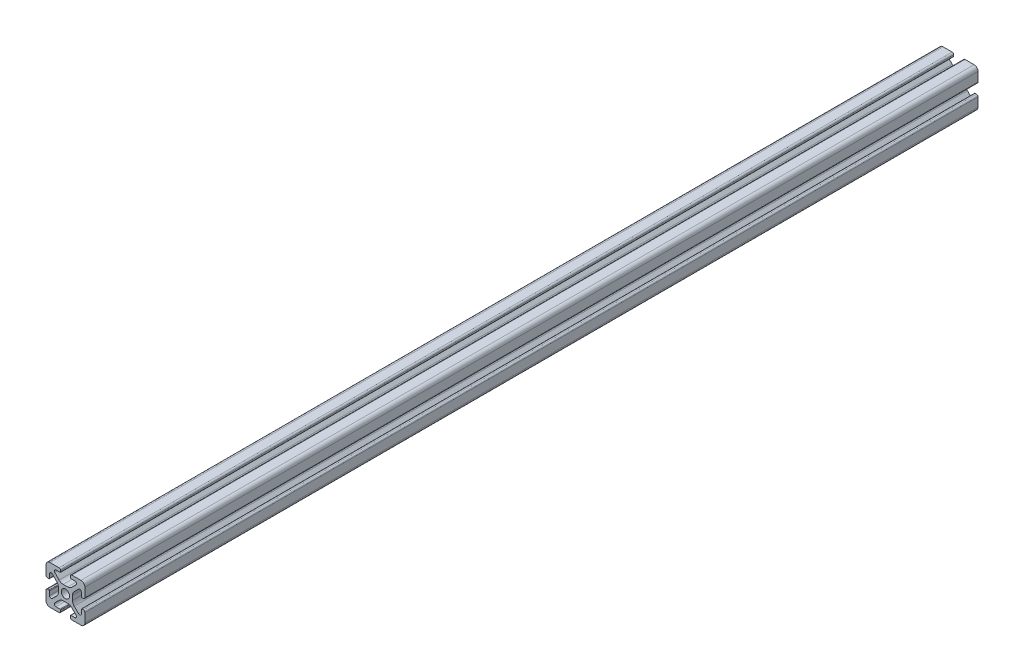
from build123d import *

# Parameters (mm, degrees)
BOSS_EXTRU_1_DEPTH = 460


with BuildPart() as part:
    # Esquisse1 → Boss.-Extru.1 (new body)
    with BuildSketch(Plane.XY):
        with BuildLine():
            Line((-3.255887446, 4.528679645), (-5.506192286, 6.778984485))
            ThreePointArc((-5.506192286, 6.778984485), (-5.686636441, 7.686138511), (-4.917588391, 8.199999989))
            Line((-4.917588391, 8.199999989), (-2.799999991, 8.199999989))
            ThreePointArc((-2.799999991, 8.199999989), (-2.587867957, 8.287867955), (-2.499999991, 8.499999989))
            Line((-2.499999991, 8.499999989), (-2.499999991, 9.199999989))
            ThreePointArc((-2.499999991, 9.199999989), (-2.734314566, 9.765685414), (-3.299999991, 9.999999989))
            Line((-3.299999991, 9.999999989), (-7.999999991, 9.999999989))
            ThreePointArc((-7.999999991, 9.999999989), (-9.414213554, 9.414213552), (-9.999999991, 7.999999989))
            Line((-9.999999991, 7.999999989), (-9.999999991, 3.299999989))
            ThreePointArc((-9.999999991, 3.299999989), (-9.765685416, 2.734314564), (-9.199999991, 2.499999989))
            Line((-9.199999991, 2.499999989), (-8.499999991, 2.499999989))
            ThreePointArc((-8.499999991, 2.499999989), (-8.287867957, 2.587867955), (-8.199999991, 2.799999989))
            Line((-8.199999991, 2.799999989), (-8.199999991, 4.917588389))
            ThreePointArc((-8.199999991, 4.917588389), (-7.686138517, 5.686636433), (-6.778984497, 5.506192279))
            Line((-6.778984497, 5.506192279), (-4.528679657, 3.255887439))
            ThreePointArc((-4.528679657, 3.255887439), (-3.878361403, 2.282617393), (-3.650000001, 1.134567096))
            Line((-3.650000001, 1.134567096), (-3.650000001, -1.134567114))
            ThreePointArc((-3.650000001, -1.134567114), (-3.878361403, -2.282617409), (-4.528679656, -3.255887454))
            Line((-4.528679656, -3.255887454), (-6.778984496, -5.506192294))
            ThreePointArc((-6.778984496, -5.506192294), (-7.686138522, -5.686636449), (-8.2, -4.9175884))
            Line((-8.2, -4.9175884), (-8.2, -2.8))
            ThreePointArc((-8.2, -2.8), (-8.287867966, -2.587867966), (-8.5, -2.5))
            Line((-8.5, -2.5), (-9.2, -2.5))
            ThreePointArc((-9.2, -2.5), (-9.765685425, -2.734314575), (-10, -3.3))
            Line((-10, -3.3), (-10, -8))
            ThreePointArc((-10, -8), (-9.414213562, -9.414213562), (-8, -10))
            Line((-8, -10), (-3.3, -10))
            ThreePointArc((-3.3, -10), (-2.734314575, -9.765685425), (-2.5, -9.2))
            Line((-2.5, -9.2), (-2.5, -8.5))
            ThreePointArc((-2.5, -8.5), (-2.587867966, -8.287867966), (-2.8, -8.2))
            Line((-2.8, -8.2), (-4.9175884, -8.2))
            ThreePointArc((-4.9175884, -8.2), (-5.686636444, -7.686138526), (-5.50619229, -6.778984506))
            Line((-5.50619229, -6.778984506), (-3.25588745, -4.528679666))
            ThreePointArc((-3.25588745, -4.528679666), (-2.282617404, -3.878361412), (-1.134567106, -3.650000009))
            Line((-1.134567106, -3.650000009), (1.134567104, -3.650000009))
            ThreePointArc((1.134567104, -3.650000009), (2.282617399, -3.878361412), (3.255887444, -4.528679664))
            Line((3.255887444, -4.528679664), (5.506192284, -6.778984504))
            ThreePointArc((5.506192284, -6.778984504), (5.686636439, -7.686138531), (4.917588389, -8.200000009))
            Line((4.917588389, -8.200000009), (2.799999989, -8.200000009))
            ThreePointArc((2.799999989, -8.200000009), (2.587867955, -8.287867974), (2.499999989, -8.500000009))
            Line((2.499999989, -8.500000009), (2.499999989, -9.200000009))
            ThreePointArc((2.499999989, -9.200000009), (2.734314564, -9.765685434), (3.299999989, -10.000000009))
            Line((3.299999989, -10.000000009), (7.999999989, -10.000000009))
            ThreePointArc((7.999999989, -10.000000009), (9.414213552, -9.414213571), (9.999999989, -8.000000009))
            Line((9.999999989, -8.000000009), (9.999999989, -3.300000009))
            ThreePointArc((9.999999989, -3.300000009), (9.765685414, -2.734314584), (9.199999989, -2.500000009))
            Line((9.199999989, -2.500000009), (8.499999989, -2.500000009))
            ThreePointArc((8.499999989, -2.500000009), (8.287867955, -2.587867974), (8.199999989, -2.800000009))
            Line((8.199999989, -2.800000009), (8.199999989, -4.917588409))
            ThreePointArc((8.199999989, -4.917588409), (7.686138515, -5.686636452), (6.778984495, -5.506192299))
            Line((6.778984495, -5.506192299), (4.528679655, -3.255887459))
            ThreePointArc((4.528679655, -3.255887459), (3.878361401, -2.282617412), (3.649999999, -1.134567115))
            Line((3.649999999, -1.134567115), (3.649999999, 1.134567095))
            ThreePointArc((3.649999999, 1.134567095), (3.878361401, 2.28261739), (4.528679654, 3.255887435))
            Line((4.528679654, 3.255887435), (6.778984494, 5.506192275))
            ThreePointArc((6.778984494, 5.506192275), (7.68613852, 5.68663643), (8.199999998, 4.917588381))
            Line((8.199999998, 4.917588381), (8.199999998, 2.799999981))
            ThreePointArc((8.199999998, 2.799999981), (8.287867964, 2.587867946), (8.499999998, 2.499999981))
            Line((8.499999998, 2.499999981), (9.199999998, 2.499999981))
            ThreePointArc((9.199999998, 2.499999981), (9.765685423, 2.734314556), (9.999999998, 3.299999981))
            Line((9.999999998, 3.299999981), (9.999999998, 7.999999981))
            ThreePointArc((9.999999998, 7.999999981), (9.41421356, 9.414213543), (7.999999998, 9.999999981))
            Line((7.999999998, 9.999999981), (3.299999998, 9.999999981))
            ThreePointArc((3.299999998, 9.999999981), (2.734314573, 9.765685406), (2.499999998, 9.199999981))
            Line((2.499999998, 9.199999981), (2.499999998, 8.499999981))
            ThreePointArc((2.499999998, 8.499999981), (2.587867964, 8.287867946), (2.799999998, 8.199999981))
            Line((2.799999998, 8.199999981), (4.917588398, 8.199999981))
            ThreePointArc((4.917588398, 8.199999981), (5.686636442, 7.686138507), (5.506192288, 6.778984487))
            Line((5.506192288, 6.778984487), (3.255887448, 4.528679647))
            ThreePointArc((3.255887448, 4.528679647), (2.282617402, 3.878361393), (1.134567104, 3.64999999))
            Line((1.134567104, 3.64999999), (-1.134567106, 3.64999999))
            ThreePointArc((-1.134567106, 3.64999999), (-2.282617401, 3.878361392), (-3.255887446, 4.528679645))
        make_face()
        with BuildLine():
            ThreePointArc((-2.15, 0), (0, -2.15), (2.15, 0))
            ThreePointArc((2.15, 0), (0, 2.15), (-2.15, 0))
        make_face(mode=Mode.SUBTRACT)
    extrude(amount=BOSS_EXTRU_1_DEPTH)


solid = part.part
